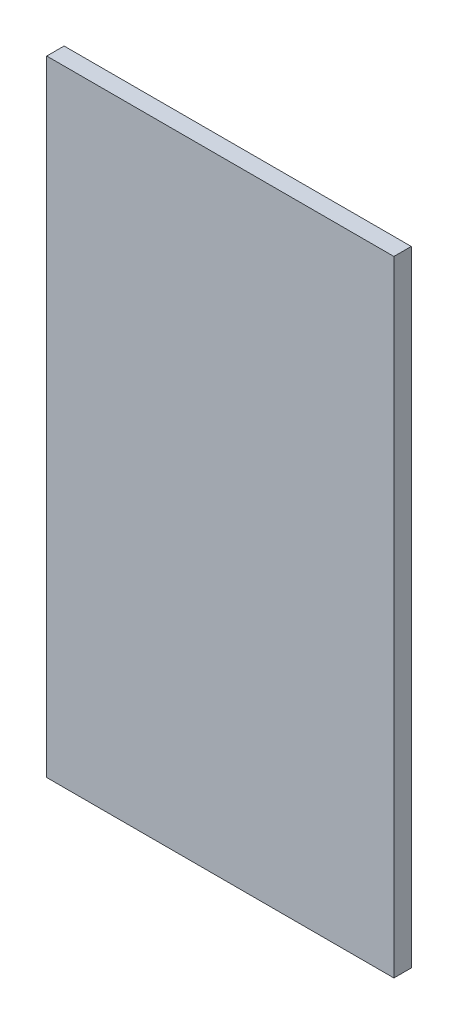
from build123d import *

# Parameters (mm, degrees)
SKETCH1_W           = 100
SKETCH1_H           = 180
BOSS_EXTRUDE1_DEPTH = 5


with BuildPart() as part:
    # Sketch1 → Boss-Extrude1 (new body)
    with BuildSketch(Plane.XY):
        Rectangle(SKETCH1_W, SKETCH1_H)
    extrude(amount=BOSS_EXTRUDE1_DEPTH)


solid = part.part
